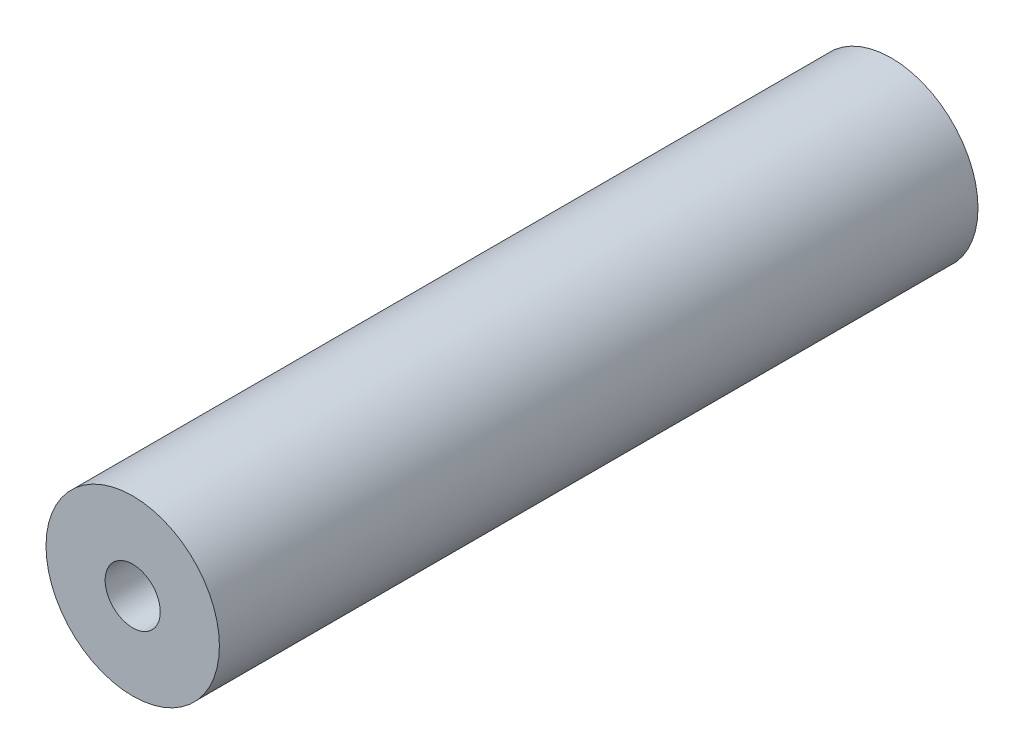
from build123d import *

# Parameters (mm, degrees)
SKETCH1_R                            = 6.35
BOSS_EXTRUDE1_DEPTH                  = 27.78125
F_10_32_TAPPED_HOLE1_D               = 4.0386
F_10_32_TAPPED_HOLE1_DEPTH           = 12.02944
F_10_32_TAPPED_HOLE1_TIP             = 1.213317848
F_10_32_TAPPED_HOLE1_ON_FACE_2_D     = 4.0386
F_10_32_TAPPED_HOLE1_ON_FACE_2_DEPTH = 12.02944
F_10_32_TAPPED_HOLE1_ON_FACE_2_TIP   = 1.213317848


with BuildPart() as part:
    # Sketch1 → Boss-Extrude1 (new, symmetric)
    with BuildSketch(Plane.XY):
        Circle(SKETCH1_R)
    extrude(amount=BOSS_EXTRUDE1_DEPTH, both=True)

    # #10-32 Tapped Hole1
    with Locations(Plane.XY.offset(27.78125)):
        with Locations((0, 0)):
            Hole(F_10_32_TAPPED_HOLE1_D / 2, depth=F_10_32_TAPPED_HOLE1_DEPTH)
            with Locations((0, 0, -(F_10_32_TAPPED_HOLE1_DEPTH + F_10_32_TAPPED_HOLE1_TIP / 2))):  # 118° drill point
                Cone(0, F_10_32_TAPPED_HOLE1_D / 2, F_10_32_TAPPED_HOLE1_TIP, mode=Mode.SUBTRACT)

    # #10-32 Tapped Hole1 on face 2
    with Locations(Plane(origin=(0, 0, -27.78125), x_dir=(-1, 0, 0), z_dir=(0, 0, -1))):
        with Locations((0, 0)):
            Hole(F_10_32_TAPPED_HOLE1_ON_FACE_2_D / 2, depth=F_10_32_TAPPED_HOLE1_ON_FACE_2_DEPTH)
            with Locations((0, 0, -(F_10_32_TAPPED_HOLE1_ON_FACE_2_DEPTH + F_10_32_TAPPED_HOLE1_ON_FACE_2_TIP / 2))):  # 118° drill point
                Cone(0, F_10_32_TAPPED_HOLE1_ON_FACE_2_D / 2, F_10_32_TAPPED_HOLE1_ON_FACE_2_TIP, mode=Mode.SUBTRACT)


solid = part.part
